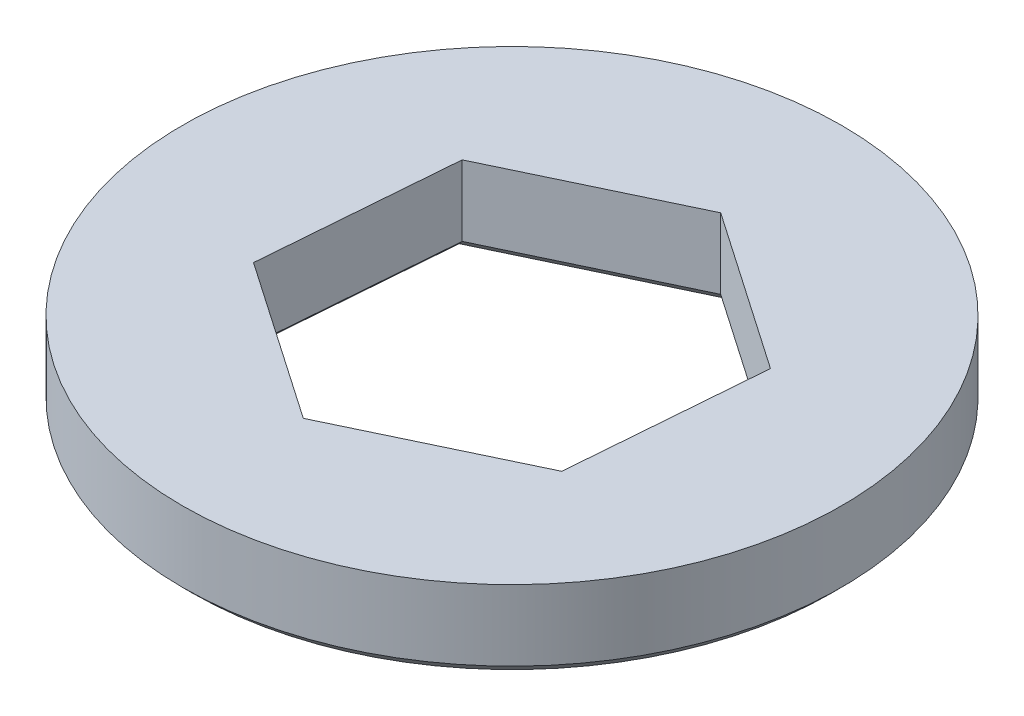
from build123d import *

# Parameters (mm, degrees)
SKETCH1_R           = 12.95
BOSS_EXTRUDE1_DEPTH = 3.175
CHAMFER1_SIZE       = 0.4


with BuildPart() as part:
    # Sketch1 → Boss-Extrude1 (new body)
    with BuildSketch(Plane(origin=(0, 0, 0), x_dir=(1, 0, 0), z_dir=(0, 1, 0))):
        with Locations(Location((0, 0, 0), (0, 0, 270))):
            Circle(SKETCH1_R)
        Polygon((0.60374079, 7.597071611), (-6.277386614, 4.321390667), (-6.881127404, -3.275680944), (-0.60374079, -7.597071611), (6.277386614, -4.321390667), (6.881127404, 3.275680944), align=None, mode=Mode.SUBTRACT)
    extrude(amount=BOSS_EXTRUDE1_DEPTH)

    # Chamfer1
    chamfer1_edges = [part.edges().sort_by_distance(p)[0] for p in [
        (-6.579257009, 0, -0.522854862),
        (-3.742434097, 0, 5.436376277),
        (2.836822912, 0, 5.959231139),
        (6.579257009, 0, 0.522854862),
        (0, 0, -12.95),
        (3.742434097, 0, -5.436376277),
        (-2.836822912, 0, -5.959231139),
    ]]
    chamfer(chamfer1_edges, length=CHAMFER1_SIZE)


solid = part.part
